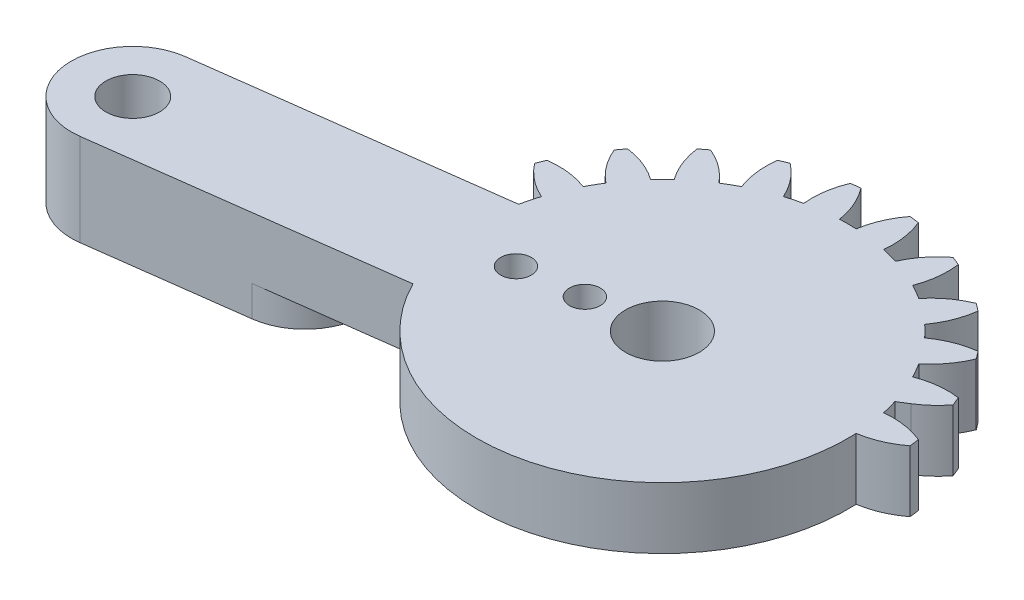
from build123d import *
from build123d.topology import SkipClean

# Parameters (mm, degrees)
SKETCH1_R           = 1.5
BOSS_EXTRUDE1_DEPTH = 4
SKETCH3_R           = 1.75
BOSS_EXTRUDE2_DEPTH = 4
CUT_EXTRUDE1_START  = -4
CUT_EXTRUDE1_DEPTH  = 4
CUT_EXTRUDE2_REACH  = 49.073
SKETCH5_R           = 2.4
SKETCH5_R_2         = 1
SKETCH8_R           = 1.75
BOSS_EXTRUDE3_DEPTH = 2


with BuildPart() as part:
    # Sketch1 → Boss-Extrude1 (new body)
    with BuildSketch(Plane(origin=(0, 0, 0), x_dir=(1, 0, 0), z_dir=(0, 1, 0))):
        with BuildLine():
            Line((20.643657446, 4), (2.081641936, 4))
            ThreePointArc((2.081641936, 4), (2.861028333, 4.588201733), (3.521749436, 5.30713988))
            ThreePointArc((3.521749436, 5.30713988), (3.405395609, 5.596745198), (3.282888305, 5.883801663))
            ThreePointArc((3.282888305, 5.883801663), (1.93527598, 5.894040025), (0.627094961, 5.57027124))
            ThreePointArc((0.627094961, 5.57027124), (0.366286148, 6.046375), (0.084372603, 6.510293938))
            ThreePointArc((0.084372603, 6.510293938), (1.018855105, 7.48132754), (1.683794586, 8.65351323))
            ThreePointArc((1.683794586, 8.65351323), (1.496450048, 8.903135899), (1.303821399, 9.148703928))
            ThreePointArc((1.303821399, 9.148703928), (-0.000522033, 8.809805691), (-1.180330337, 8.158486898))
            ThreePointArc((-1.180330337, 8.158486898), (-1.555477026, 8.550865528), (-1.947855656, 8.926012217))
            ThreePointArc((-1.947855656, 8.926012217), (-1.296536862, 10.105820521), (-0.957638625, 11.410163953))
            ThreePointArc((-0.957638625, 11.410163953), (-1.203206655, 11.602792602), (-1.452829324, 11.79013714))
            ThreePointArc((-1.452829324, 11.79013714), (-2.625015014, 11.125197659), (-3.596048616, 10.190715157))
            ThreePointArc((-3.596048616, 10.190715157), (-4.059967554, 10.472628702), (-4.536071314, 10.733437515))
            ThreePointArc((-4.536071314, 10.733437515), (-4.212302529, 12.041618533), (-4.222540891, 13.389230859))
            ThreePointArc((-4.222540891, 13.389230859), (-4.509597355, 13.511738163), (-4.799202674, 13.62809199))
            ThreePointArc((-4.799202674, 13.62809199), (-5.759348103, 12.682425791), (-6.455432668, 11.528463019))
            ThreePointArc((-6.455432668, 11.528463019), (-6.976508546, 11.680699536), (-7.503891752, 11.809396783))
            ThreePointArc((-7.503891752, 11.809396783), (-7.529737283, 13.156800143), (-7.888414517, 14.455843809))
            ThreePointArc((-7.888414517, 14.455843809), (-8.197396993, 14.499881098), (-8.507248835, 14.537314892))
            ThreePointArc((-8.507248835, 14.537314892), (-9.18992168, 13.375367565), (-9.563620196, 12.080565177))
            ThreePointArc((-9.563620196, 12.080565177), (-10.106342554, 12.09275), (-10.649064912, 12.080565177))
            ThreePointArc((-10.649064912, 12.080565177), (-11.022763428, 13.375367565), (-11.705436272, 14.537314892))
            ThreePointArc((-11.705436272, 14.537314892), (-12.015288115, 14.499881098), (-12.324270591, 14.455843809))
            ThreePointArc((-12.324270591, 14.455843809), (-12.682947825, 13.156800143), (-12.708793355, 11.809396783))
            ThreePointArc((-12.708793355, 11.809396783), (-13.236176561, 11.680699536), (-13.757252439, 11.528463019))
            ThreePointArc((-13.757252439, 11.528463019), (-14.453337005, 12.682425791), (-15.413482434, 13.62809199))
            ThreePointArc((-15.413482434, 13.62809199), (-15.703087752, 13.511738163), (-15.990144217, 13.389230859))
            ThreePointArc((-15.990144217, 13.389230859), (-16.000382579, 12.041618533), (-15.676613793, 10.733437515))
            ThreePointArc((-15.676613793, 10.733437515), (-16.152717554, 10.472628702), (-16.616636492, 10.190715157))
            ThreePointArc((-16.616636492, 10.190715157), (-17.587670094, 11.125197659), (-18.759855783, 11.79013714))
            ThreePointArc((-18.759855783, 11.79013714), (-19.009478453, 11.602792602), (-19.255046482, 11.410163953))
            ThreePointArc((-19.255046482, 11.410163953), (-18.916148245, 10.105820521), (-18.264829452, 8.926012217))
            ThreePointArc((-18.264829452, 8.926012217), (-18.657208082, 8.550865528), (-19.032354771, 8.158486898))
            ThreePointArc((-19.032354771, 8.158486898), (-20.212163074, 8.809805691), (-21.516506507, 9.148703928))
            ThreePointArc((-21.516506507, 9.148703928), (-21.709135156, 8.903135899), (-21.896479694, 8.65351323))
            ThreePointArc((-21.896479694, 8.65351323), (-21.231540213, 7.48132754), (-20.297057711, 6.510293938))
            ThreePointArc((-20.297057711, 6.510293938), (-20.578971255, 6.046375), (-20.839780068, 5.57027124))
            ThreePointArc((-20.839780068, 5.57027124), (-22.147961087, 5.894040025), (-23.495573413, 5.883801663))
            ThreePointArc((-23.495573413, 5.883801663), (-23.618080717, 5.596745198), (-23.734434544, 5.30713988))
            ThreePointArc((-23.734434544, 5.30713988), (-22.788768345, 4.346994451), (-21.634805572, 3.650909885))
            ThreePointArc((-21.634805572, 3.650909885), (-21.78704209, 3.129834008), (-21.915739337, 2.602450802))
            ThreePointArc((-21.915739337, 2.602450802), (-23.263142697, 2.576605271), (-24.562186363, 2.217928037))
            ThreePointArc((-24.562186363, 2.217928037), (-24.606223651, 1.908945561), (-24.643657446, 1.599093719))
            ThreePointArc((-24.643657446, 1.599093719), (-23.481710119, 0.916420874), (-22.186907731, 0.542722358))
            ThreePointArc((-22.186907731, 0.542722358), (-22.199092554, 0), (-22.186907731, -0.542722358))
            ThreePointArc((-22.186907731, -0.542722358), (-23.481710119, -0.916420874), (-24.643657446, -1.599093719))
            ThreePointArc((-24.643657446, -1.599093719), (-24.606223651, -1.908945561), (-24.562186363, -2.217928037))
            ThreePointArc((-24.562186363, -2.217928037), (-23.263142697, -2.576605271), (-21.915739337, -2.602450802))
            ThreePointArc((-21.915739337, -2.602450802), (-21.78704209, -3.129834008), (-21.634805572, -3.650909885))
            ThreePointArc((-21.634805572, -3.650909885), (-22.788768345, -4.346994451), (-23.734434544, -5.30713988))
            ThreePointArc((-23.734434544, -5.30713988), (-23.618080717, -5.596745198), (-23.495573413, -5.883801663))
            ThreePointArc((-23.495573413, -5.883801663), (-22.147961087, -5.894040025), (-20.839780068, -5.57027124))
            ThreePointArc((-20.839780068, -5.57027124), (-20.578971255, -6.046375), (-20.297057711, -6.510293938))
            ThreePointArc((-20.297057711, -6.510293938), (-21.231540213, -7.48132754), (-21.896479694, -8.65351323))
            ThreePointArc((-21.896479694, -8.65351323), (-21.709135156, -8.903135899), (-21.516506507, -9.148703928))
            ThreePointArc((-21.516506507, -9.148703928), (-20.212163074, -8.809805691), (-19.032354771, -8.158486898))
            ThreePointArc((-19.032354771, -8.158486898), (-18.657208082, -8.550865528), (-18.264829452, -8.926012217))
            ThreePointArc((-18.264829452, -8.926012217), (-18.916148245, -10.105820521), (-19.255046482, -11.410163953))
            ThreePointArc((-19.255046482, -11.410163953), (-19.009478453, -11.602792602), (-18.759855783, -11.79013714))
            ThreePointArc((-18.759855783, -11.79013714), (-17.587670094, -11.125197659), (-16.616636492, -10.190715157))
            ThreePointArc((-16.616636492, -10.190715157), (-16.152717554, -10.472628702), (-15.676613793, -10.733437515))
            ThreePointArc((-15.676613793, -10.733437515), (-16.000382579, -12.041618533), (-15.990144217, -13.389230859))
            ThreePointArc((-15.990144217, -13.389230859), (-15.703087752, -13.511738163), (-15.413482434, -13.62809199))
            ThreePointArc((-15.413482434, -13.62809199), (-14.453337005, -12.682425791), (-13.757252439, -11.528463019))
            ThreePointArc((-13.757252439, -11.528463019), (-13.236176561, -11.680699536), (-12.708793355, -11.809396783))
            ThreePointArc((-12.708793355, -11.809396783), (-12.682947825, -13.156800143), (-12.324270591, -14.455843809))
            ThreePointArc((-12.324270591, -14.455843809), (-12.015288115, -14.499881098), (-11.705436272, -14.537314892))
            ThreePointArc((-11.705436272, -14.537314892), (-11.022763428, -13.375367565), (-10.649064912, -12.080565177))
            ThreePointArc((-10.649064912, -12.080565177), (-10.106342554, -12.09275), (-9.563620196, -12.080565177))
            ThreePointArc((-9.563620196, -12.080565177), (-9.18992168, -13.375367565), (-8.507248835, -14.537314892))
            ThreePointArc((-8.507248835, -14.537314892), (-8.197396993, -14.499881098), (-7.888414517, -14.455843809))
            ThreePointArc((-7.888414517, -14.455843809), (-7.529737283, -13.156800143), (-7.503891752, -11.809396783))
            ThreePointArc((-7.503891752, -11.809396783), (-6.976508546, -11.680699536), (-6.455432668, -11.528463019))
            ThreePointArc((-6.455432668, -11.528463019), (-5.759348103, -12.682425791), (-4.799202674, -13.62809199))
            ThreePointArc((-4.799202674, -13.62809199), (-4.509597355, -13.511738163), (-4.222540891, -13.389230859))
            ThreePointArc((-4.222540891, -13.389230859), (-4.212302529, -12.041618533), (-4.536071314, -10.733437515))
            ThreePointArc((-4.536071314, -10.733437515), (-4.059967554, -10.472628702), (-3.596048616, -10.190715157))
            ThreePointArc((-3.596048616, -10.190715157), (-2.625015014, -11.125197659), (-1.452829324, -11.79013714))
            ThreePointArc((-1.452829324, -11.79013714), (-1.203206655, -11.602792602), (-0.957638625, -11.410163953))
            ThreePointArc((-0.957638625, -11.410163953), (-1.296536862, -10.105820521), (-1.947855656, -8.926012217))
            ThreePointArc((-1.947855656, -8.926012217), (-1.555477026, -8.550865528), (-1.180330337, -8.158486898))
            ThreePointArc((-1.180330337, -8.158486898), (-0.000522033, -8.809805691), (1.303821399, -9.148703928))
            ThreePointArc((1.303821399, -9.148703928), (1.496450048, -8.903135899), (1.683794586, -8.65351323))
            ThreePointArc((1.683794586, -8.65351323), (1.018855105, -7.48132754), (0.084372603, -6.510293938))
            ThreePointArc((0.084372603, -6.510293938), (0.366286148, -6.046375), (0.627094961, -5.57027124))
            ThreePointArc((0.627094961, -5.57027124), (1.93527598, -5.894040025), (3.282888305, -5.883801663))
            ThreePointArc((3.282888305, -5.883801663), (3.405395609, -5.596745198), (3.521749436, -5.30713988))
            ThreePointArc((3.521749436, -5.30713988), (2.861028333, -4.588201733), (2.081641936, -4))
            Line((2.081641936, -4), (20.643657446, -4))
            ThreePointArc((20.643657446, -4), (24.643657446, 0), (20.643657446, 4))
        make_face()
        with Locations(Location((-10.106342554, 0, 0), (0, 0, 270))):
            Circle(SKETCH1_R, mode=Mode.SUBTRACT)
        with Locations(Location((20.643657446, 0, 0), (0, 0, 270))):
            Circle(SKETCH1_R, mode=Mode.SUBTRACT)
    extrude(amount=BOSS_EXTRUDE1_DEPTH)

    # Sketch3 → Boss-Extrude2 (add)
    with BuildSketch(Plane(origin=(0, 4, 0), x_dir=(1, 0, 0), z_dir=(0, 1, 0))):
        with BuildLine():
            ThreePointArc((-9.584237785, -3.965779445), (-14.072121999, -0.522104769), (-10.628447323, 3.965779445))
            Line((-10.628447323, 3.965779445), (-41.11537681, -0.047900965))
            ThreePointArc((-41.11537681, -0.047900965), (-44.559051487, -4.53578518), (-40.071167272, -7.979459856))
            Line((-40.071167272, -7.979459856), (-9.584237785, -3.965779445))
        make_face()
        with Locations(Location((-40.593272041, -4.013680411, 0), (0, 0, 270))):
            Circle(SKETCH3_R, mode=Mode.SUBTRACT)
    extrude(amount=-BOSS_EXTRUDE2_DEPTH)

    # Sketch4 → Cut-Extrude1 (cut)
    with SkipClean():  # the faces are left unmerged after this step: merging them gives an invalid solid
        with BuildSketch(Plane(origin=(0, 4, 0), x_dir=(1, 0, 0), z_dir=(0, 1, 0)).offset(CUT_EXTRUDE1_START)):
            with BuildLine():
                ThreePointArc((20.643657446, -4), (24.643657446, 0), (20.643657446, 4))
                Line((20.643657446, 4), (2.081641936, 4))
                Line((2.081641936, 4), (1.43808022, 3.600125745))
                ThreePointArc((1.43808022, 3.600125745), (1.581217534, 3.104116905), (1.70305423, 2.602450802))
                ThreePointArc((1.70305423, 2.602450802), (3.050457589, 2.576605271), (4.349501255, 2.217928037))
                ThreePointArc((4.349501255, 2.217928037), (4.393538544, 1.908945561), (4.430972339, 1.599093719))
                ThreePointArc((4.430972339, 1.599093719), (3.269025011, 0.916420874), (1.974222624, 0.542722358))
                ThreePointArc((1.974222624, 0.542722358), (1.70305423, -2.602450802), (0.627094961, -5.57027124))
                ThreePointArc((0.627094961, -5.57027124), (1.93527598, -5.894040025), (3.282888305, -5.883801663))
                ThreePointArc((3.282888305, -5.883801663), (3.405395609, -5.596745198), (3.521749436, -5.30713988))
                ThreePointArc((3.521749436, -5.30713988), (2.861028333, -4.588201733), (2.081641936, -4))
                Line((2.081641936, -4), (20.643657446, -4))
            make_face()
            with BuildLine():
                ThreePointArc((1.683794586, -8.65351323), (1.018855105, -7.48132754), (0.084372603, -6.510293938))
                ThreePointArc((0.084372603, -6.510293938), (-0.512518948, -7.361599771), (-1.180330337, -8.158486898))
                ThreePointArc((-1.180330337, -8.158486898), (-0.000522033, -8.809805691), (1.303821399, -9.148703928))
                ThreePointArc((1.303821399, -9.148703928), (1.496450048, -8.903135899), (1.683794586, -8.65351323))
            make_face()
            with BuildLine():
                ThreePointArc((-0.957638625, -11.410163953), (-1.296536862, -10.105820521), (-1.947855656, -8.926012217))
                ThreePointArc((-1.947855656, -8.926012217), (-2.744742783, -9.593823606), (-3.596048616, -10.190715157))
                ThreePointArc((-3.596048616, -10.190715157), (-2.625015014, -11.125197659), (-1.452829324, -11.79013714))
                ThreePointArc((-1.452829324, -11.79013714), (-1.203206655, -11.602792602), (-0.957638625, -11.410163953))
            make_face()
            with BuildLine():
                ThreePointArc((-4.222540891, -13.389230859), (-4.212302529, -12.041618533), (-4.536071314, -10.733437515))
                ThreePointArc((-4.536071314, -10.733437515), (-5.478647477, -11.172244217), (-6.455432668, -11.528463019))
                ThreePointArc((-6.455432668, -11.528463019), (-5.759348103, -12.682425791), (-4.799202674, -13.62809199))
                ThreePointArc((-4.799202674, -13.62809199), (-4.509597355, -13.511738163), (-4.222540891, -13.389230859))
            make_face()
            with BuildLine():
                ThreePointArc((-7.888414517, -14.455843809), (-7.529737283, -13.156800143), (-7.503891752, -11.809396783))
                ThreePointArc((-7.503891752, -11.809396783), (-8.527921943, -11.989294847), (-9.563620196, -12.080565177))
                ThreePointArc((-9.563620196, -12.080565177), (-9.18992168, -13.375367565), (-8.507248835, -14.537314892))
                ThreePointArc((-8.507248835, -14.537314892), (-8.197396993, -14.499881098), (-7.888414517, -14.455843809))
            make_face()
            with BuildLine():
                ThreePointArc((-11.705436272, -14.537314892), (-11.022763428, -13.375367565), (-10.649064912, -12.080565177))
                ThreePointArc((-10.649064912, -12.080565177), (-11.684763165, -11.989294847), (-12.708793355, -11.809396783))
                ThreePointArc((-12.708793355, -11.809396783), (-12.682947825, -13.156800143), (-12.324270591, -14.455843809))
                ThreePointArc((-12.324270591, -14.455843809), (-12.015288115, -14.499881098), (-11.705436272, -14.537314892))
            make_face()
            with BuildLine():
                ThreePointArc((-15.413482434, -13.62809199), (-14.453337005, -12.682425791), (-13.757252439, -11.528463019))
                ThreePointArc((-13.757252439, -11.528463019), (-14.734037631, -11.172244217), (-15.676613793, -10.733437515))
                ThreePointArc((-15.676613793, -10.733437515), (-16.000382579, -12.041618533), (-15.990144217, -13.389230859))
                ThreePointArc((-15.990144217, -13.389230859), (-15.703087752, -13.511738163), (-15.413482434, -13.62809199))
            make_face()
            with BuildLine():
                ThreePointArc((-18.759855783, -11.79013714), (-17.587670094, -11.125197659), (-16.616636492, -10.190715157))
                ThreePointArc((-16.616636492, -10.190715157), (-17.467942324, -9.593823606), (-18.264829452, -8.926012217))
                ThreePointArc((-18.264829452, -8.926012217), (-18.916148245, -10.105820521), (-19.255046482, -11.410163953))
                ThreePointArc((-19.255046482, -11.410163953), (-19.009478453, -11.602792602), (-18.759855783, -11.79013714))
            make_face()
            with BuildLine():
                ThreePointArc((-21.516506507, -9.148703928), (-20.212163074, -8.809805691), (-19.032354771, -8.158486898))
                ThreePointArc((-19.032354771, -8.158486898), (-19.70016616, -7.361599771), (-20.297057711, -6.510293938))
                ThreePointArc((-20.297057711, -6.510293938), (-21.231540213, -7.48132754), (-21.896479694, -8.65351323))
                ThreePointArc((-21.896479694, -8.65351323), (-21.709135156, -8.903135899), (-21.516506507, -9.148703928))
            make_face()
            with BuildLine():
                ThreePointArc((-21.942853375, 2.47620963), (-21.92946485, 2.539366405), (-21.915739337, 2.602450802))
                ThreePointArc((-21.915739337, 2.602450802), (-23.263142697, 2.576605271), (-24.562186363, 2.217928037))
                ThreePointArc((-24.562186363, 2.217928037), (-24.56889027, 2.173784387), (-24.575459377, 2.129620475))
                Line((-24.575459377, 2.129620475), (-21.942853375, 2.47620963))
            make_face()
            with BuildLine():
                ThreePointArc((-23.495573413, -5.883801663), (-22.147961087, -5.894040025), (-20.839780068, -5.57027124))
                ThreePointArc((-20.839780068, -5.57027124), (-20.869365339, -5.512888815), (-20.898643838, -5.455349261))
                Line((-20.898643838, -5.455349261), (-23.531249839, -5.801938416))
                ThreePointArc((-23.531249839, -5.801938416), (-23.513474108, -5.842897269), (-23.495573413, -5.883801663))
            make_face()
        extrude(amount=CUT_EXTRUDE1_DEPTH, mode=Mode.SUBTRACT)

    # Sketch5 → Cut-Extrude2 (cut, up to next)
    with BuildSketch(Plane(origin=(0, 4, 0), x_dir=(1, 0, 0), z_dir=(0, 1, 0)), mode=Mode.PRIVATE) as cut_extrude2_sk1:
        with Locations(Location((-10.106342554, 0, 0), (0, 0, 270))):
            Circle(SKETCH5_R)
    cut_extrude2_tool1 = extrude(cut_extrude2_sk1.sketch, amount=-CUT_EXTRUDE2_REACH, mode=Mode.PRIVATE) & part.part
    # Sketch5 → Cut-Extrude2 (cut, up to next)
    with BuildSketch(Plane(origin=(0, 4, 0), x_dir=(1, 0, 0), z_dir=(0, 1, 0)), mode=Mode.PRIVATE) as cut_extrude2_sk2:
        with Locations(Location((-14.56784443, -0.587367865, 0), (0, 0, 270))):
            Circle(SKETCH5_R_2)
    cut_extrude2_tool2 = extrude(cut_extrude2_sk2.sketch, amount=-CUT_EXTRUDE2_REACH, mode=Mode.PRIVATE) & part.part
    # Sketch5 → Cut-Extrude2 (cut, up to next)
    with BuildSketch(Plane(origin=(0, 4, 0), x_dir=(1, 0, 0), z_dir=(0, 1, 0)), mode=Mode.PRIVATE) as cut_extrude2_sk3:
        with Locations(Location((-18.533623876, -1.109472634, 0), (0, 0, 270))):
            Circle(SKETCH5_R_2)
    cut_extrude2_tool3 = extrude(cut_extrude2_sk3.sketch, amount=-CUT_EXTRUDE2_REACH, mode=Mode.PRIVATE) & part.part
    add(cut_extrude2_tool1.solids().sort_by_distance((-10.106343, 4, 0))[0], mode=Mode.SUBTRACT)
    add(cut_extrude2_tool2.solids().sort_by_distance((-14.567844, 4, 0.587368))[0], mode=Mode.SUBTRACT)
    add(cut_extrude2_tool3.solids().sort_by_distance((-18.533624, 4, 1.109473))[0], mode=Mode.SUBTRACT)

    # Sketch8 → Boss-Extrude3 (add)
    with SkipClean():  # the faces are left unmerged after this step: merging them gives an invalid solid
        with BuildSketch(Plane.XZ):
            with BuildLine():
                Line((-30.156718658, 6.674197934), (-40.071167272, 7.979459856))
                ThreePointArc((-40.071167272, 7.979459856), (-44.559051487, 4.53578518), (-41.11537681, 0.047900965))
                Line((-41.11537681, 0.047900965), (-31.200928196, -1.257360957))
                ThreePointArc((-31.200928196, -1.257360957), (-26.713043982, 2.18631372), (-30.156718658, 6.674197934))
            make_face()
            with Locations(Location((-40.593272041, 4.013680411, 0), (0, 0, 90))):
                Circle(SKETCH8_R, mode=Mode.SUBTRACT)
        extrude(amount=BOSS_EXTRUDE3_DEPTH)


solid = part.part
